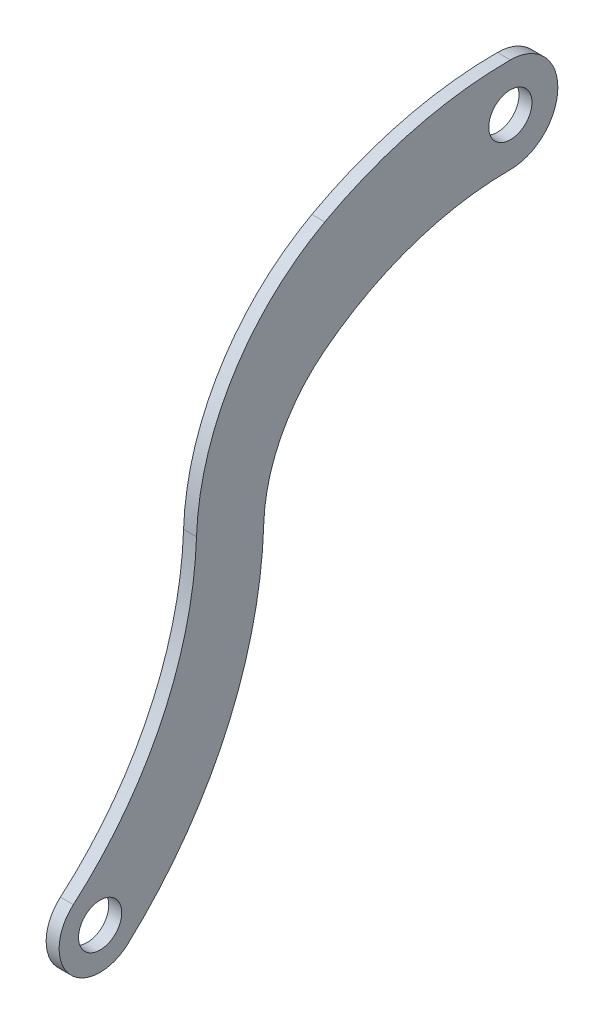
from build123d import *

# Parameters (mm, degrees)
BOSS_EXTRUDE1_DEPTH = 1.5
SKETCH2_R           = 5
CUT_EXTRUDE1_DEPTH  = 146.362477965


with BuildPart() as part:
    # Sketch1 → Boss-Extrude1 (new, symmetric)
    with BuildSketch(Plane(origin=(0, 0, 0), x_dir=(0, 0, -1), z_dir=(1, 0, 0))):
        with BuildLine():
            ThreePointArc((0, 79), (11, 90), (0, 101))
            ThreePointArc((0, 101), (-22.175202553, 98.206354436), (-42.964618387, 90))
            ThreePointArc((-42.964618387, 90), (-64.215202534, 69.79393834), (-72.677183828, 41.717843046))
            ThreePointArc((-72.677183828, 41.717843046), (-80.702786034, 8.970580762), (-101.198646906, -17.800918355))
            ThreePointArc((-101.198646906, -17.800918355), (-102.106646609, -31.304409091), (-88.591206955, -32.012657963))
            ThreePointArc((-88.591206955, -32.012657963), (-65.917364071, -0.956571375), (-57.106346845, 36.472690449))
            ThreePointArc((-57.106346845, 36.472690449), (-53.137218062, 51.946403572), (-42.964618387, 64.263383599))
            ThreePointArc((-42.964618387, 64.263383599), (-22.710825041, 75.213430858), (0, 79))
        make_face()
    extrude(amount=BOSS_EXTRUDE1_DEPTH, both=True)

    # Sketch2 → Cut-Extrude1 (cut, through all)
    with BuildSketch(Plane(origin=(1.5, 0, 0), x_dir=(0, 0, -1), z_dir=(1, 0, 0))):
        with Locations((0, 90)):
            Circle(SKETCH2_R)
        with Locations((-95, -25)):
            Circle(SKETCH2_R)
    extrude(amount=-CUT_EXTRUDE1_DEPTH, mode=Mode.SUBTRACT)


solid = part.part
